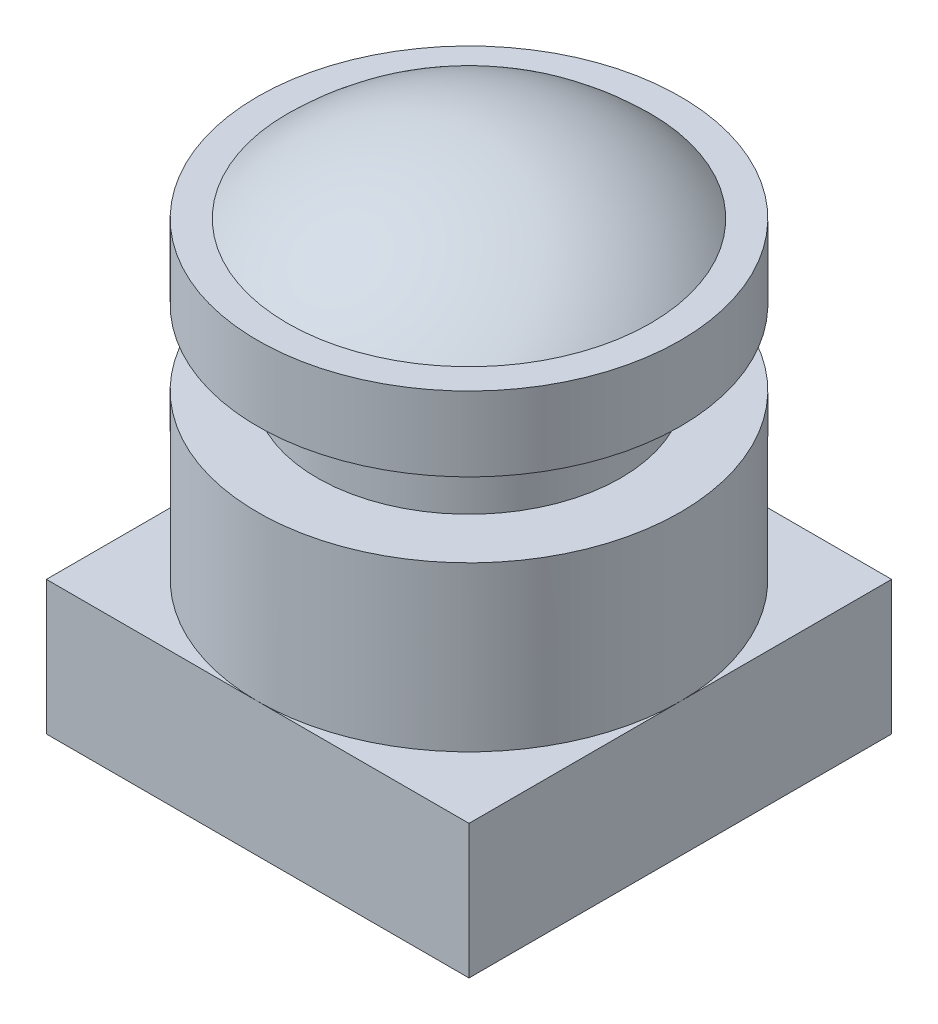
from build123d import *

# Parameters (mm, degrees)
SKETCH3_W           = 14.2
SKETCH3_H           = 14.2
BOSS_EXTRUDE1_DEPTH = 4.5


with BuildPart() as part:
    # Sketch2 → Revolve1 (revolve)
    with BuildSketch(Plane.XY):
        with BuildLine():
            Line((0, 0), (0, 13))
            ThreePointArc((0, 13), (3.296209945, 12.350752265), (6.1, 10.5))
            Line((6.1, 10.5), (7.1, 10.5))
            Line((7.1, 10.5), (7.1, 8))
            Line((7.1, 8), (5.1, 8))
            Line((5.1, 8), (5.1, 5.5))
            Line((5.1, 5.5), (7.1, 5.5))
            Line((7.1, 5.5), (7.1, 0))
            Line((7.1, 0), (0, 0))
        make_face()
    revolve(axis=Axis((0, 0, 0), (0, 1, 0)))

    # Sketch3 → Boss-Extrude1 (add)
    with BuildSketch(Plane(origin=(0, 0, 0), x_dir=(1, 0, 0), z_dir=(0, 1, 0))):
        Rectangle(SKETCH3_W, SKETCH3_H)
    extrude(amount=-BOSS_EXTRUDE1_DEPTH)


solid = part.part
